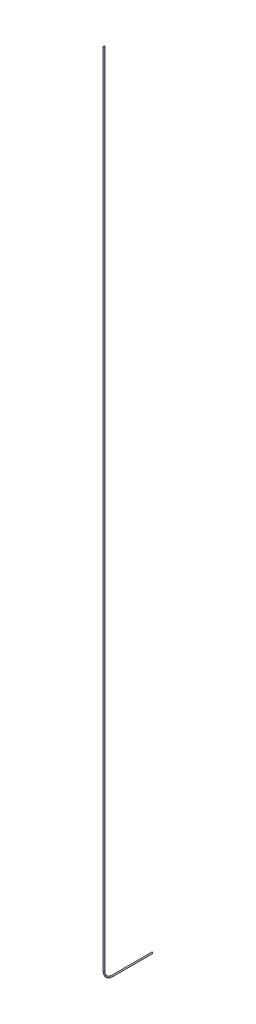
from build123d import *

# Parameters (mm, degrees)
SKETCH_1_R      = 0.4
EXTRUDE_1_DEPTH = 20
SKETCH_2_R      = 0.4


with BuildPart() as part:
    # ｽｹｯﾁ1 → ﾎﾞｽ - 押し出し1 (new body)
    with BuildSketch(Plane.XY):
        Circle(SKETCH_1_R)
    extrude(amount=EXTRUDE_1_DEPTH)

    # ｽｲｰﾌﾟ1: sweep along a path in ｽｹｯﾁ3
    with BuildLine(Plane(origin=(0, 0, 0), x_dir=(0, 0, -1), z_dir=(1, 0, 0))) as sweep_1_path:
        Line((-20, 0), (-25, 0))
        ThreePointArc((-25, 0), (-28.535533906, 1.464466094), (-30, 5))
        Line((-30, 5), (-30, 505))
    # ｽｹｯﾁ2 → ｽｲｰﾌﾟ1 (sweep)
    with BuildSketch(Plane.XY.offset(20)):
        Circle(SKETCH_2_R)
    sweep(path=sweep_1_path.line)


solid = part.part
